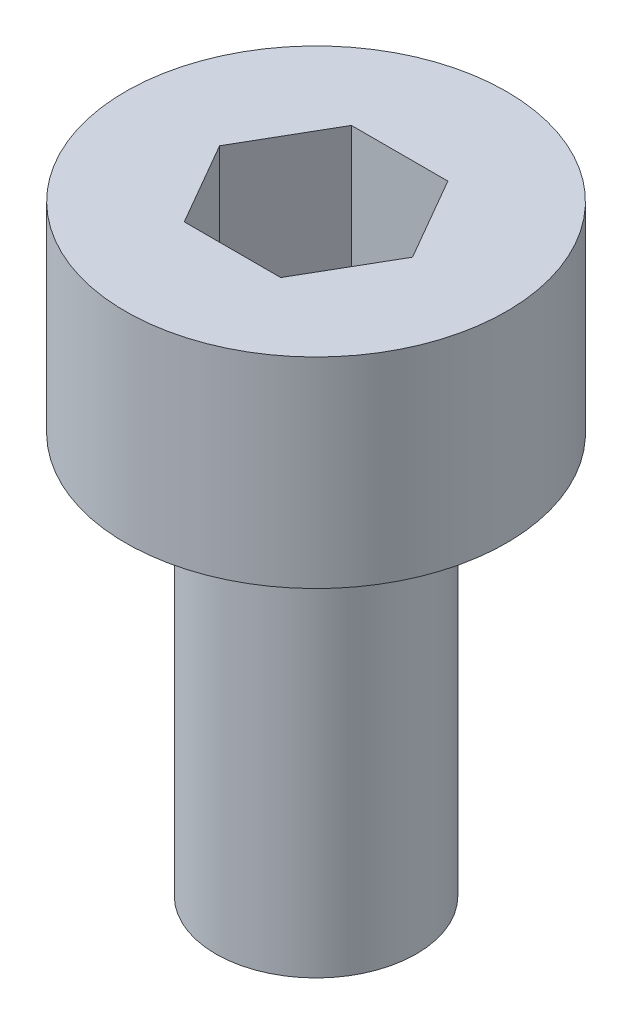
from build123d import *

# Parameters (mm, degrees)
CUT_EXTRUDE1_DEPTH = 2


with BuildPart() as part:
    # Sketch1 → Revolve1 (revolve)
    with BuildSketch(Plane(origin=(0, 0, 0), x_dir=(0, 0, -1), z_dir=(1, 0, 0))):
        Polygon((0, -6), (1.5, -6), (1.5, 0), (2.85, 0), (2.85, 3), (0, 3), align=None)
    revolve(axis=Axis((0, 4, 0), (0, 1, 0)))

    # Sketch3 → Cut-Extrude1 (cut)
    with BuildSketch(Plane(origin=(0, 3, 0), x_dir=(1, 0, 0), z_dir=(0, 1, 0))):
        Polygon((1.443375673, 0), (0.721687836, 1.25), (-0.721687836, 1.25), (-1.443375673, 0), (-0.721687836, -1.25), (0.721687836, -1.25), align=None)
    extrude(amount=-CUT_EXTRUDE1_DEPTH, mode=Mode.SUBTRACT)


solid = part.part
